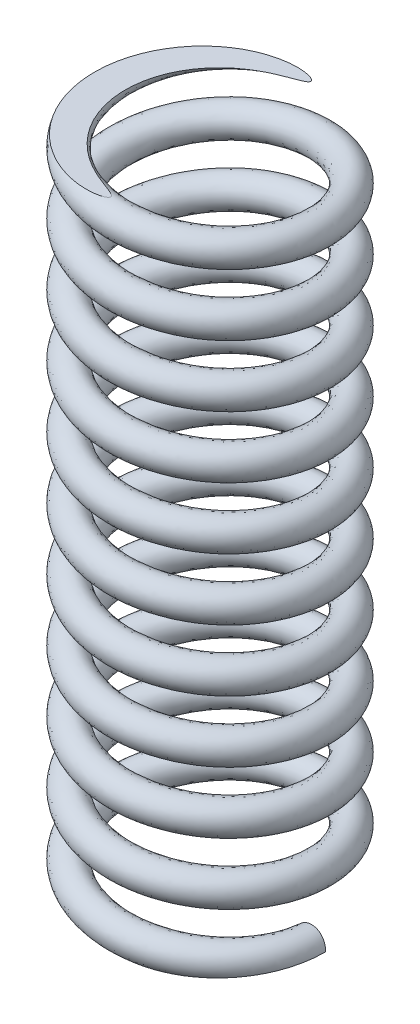
from build123d import *

# Parameters (mm, degrees)
SWEEP1_PITCH        = 2
SWEEP1_HEIGHT       = 22
SWEEP1_RADIUS       = 3.25
SWEEP1_START_ANGLE  = 90
SKETCH2_R           = 0.5
EXTRUDE1_DEPTH      = 10
EXTRUDE1_DEPTH_BACK = 10
SKETCH3_W           = 8
SKETCH3_H           = 3


with BuildPart() as part:
    # Sweep1: sweep along a helix
    with BuildLine() as sweep1_path:
        add(Helix(SWEEP1_PITCH, SWEEP1_HEIGHT, SWEEP1_RADIUS, center=(0, 0, 0), direction=(0, 1, 0), lefthand=True, mode=Mode.PRIVATE).rotate(Axis((0, 0, 0), (0, 1, 0)), SWEEP1_START_ANGLE))
    # Sketch2 → Sweep1 (sweep)
    with BuildSketch(Plane(origin=(3.25, 0, 0), x_dir=(1, 0, 0), z_dir=(4.084159025639519e-15, 0.09747510244715202, 0.9952379637066289))):
        Circle(SKETCH2_R)
    sweep(path=sweep1_path.line, is_frenet=True)

    # Sketch3 → Extrude1 (cut, two sides: drawn at the far end of the back side and taken through both)
    with BuildSketch(Plane.XY.offset(-EXTRUDE1_DEPTH_BACK)):
        with Locations((0, -1.5)):
            Rectangle(SKETCH3_W, SKETCH3_H)
        with Locations((0, 22.5)):
            Rectangle(SKETCH3_W, SKETCH3_H)
    extrude(amount=EXTRUDE1_DEPTH + EXTRUDE1_DEPTH_BACK, mode=Mode.SUBTRACT)


solid = part.part
